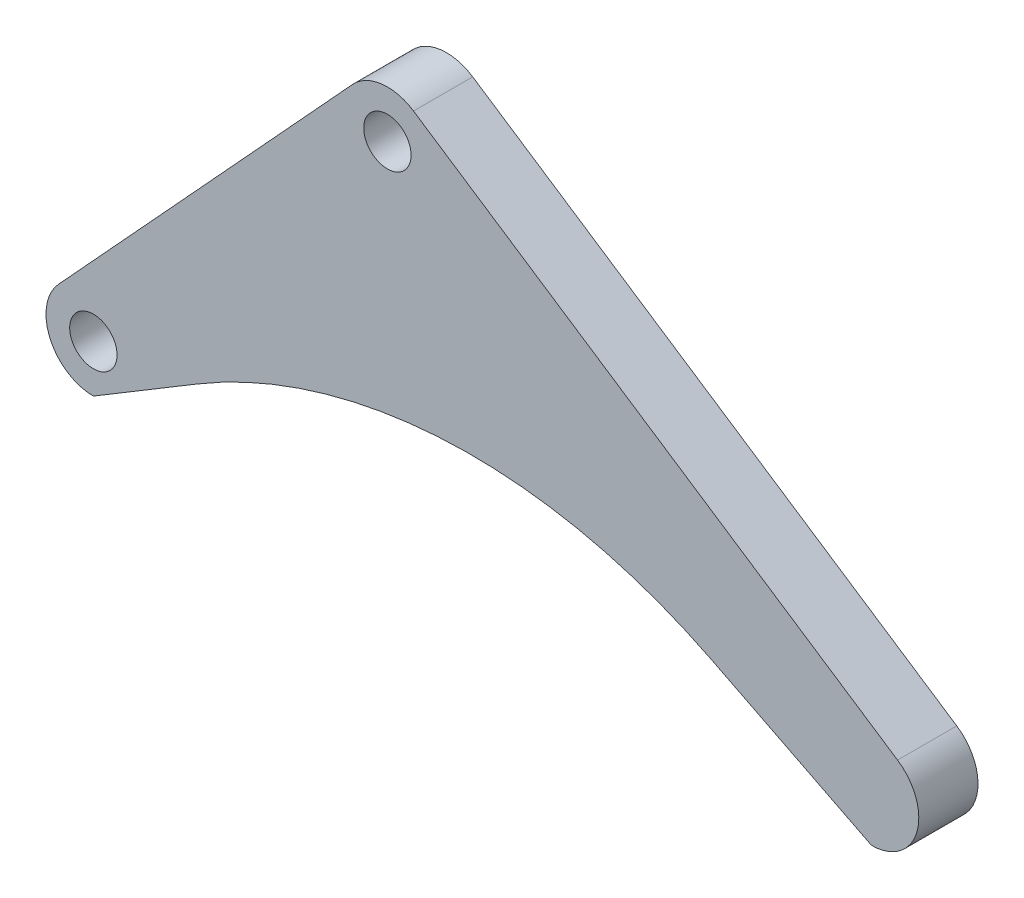
from build123d import *

# Parameters (mm, degrees)
SKETCH_2_R      = 2
EXTRUDE_1_DEPTH = 2.5


with BuildPart() as part:
    # 草圖2 → 填料-伸長1 (new, symmetric)
    with BuildSketch(Plane.XY):
        with BuildLine():
            Line((27.034153101, 30.363667163), (67.906299219, 3.336501724))
            ThreePointArc((67.906299219, 3.336501724), (69.530535661, -1.151953364), (65.7, -4))
            Line((65.7, -4), (52.175653003, 2.831217066))
            ThreePointArc((52.175653003, 2.831217066), (30.231729467, 7.633890773), (8.700316547, 1.230788983))
            Line((8.700316547, 1.230788983), (0, -4))
            ThreePointArc((0, -4), (-3.662248796, -1.608705616), (-2.945740102, 2.706033121))
            Line((-2.945740102, 2.706033121), (21.882113779, 29.733198559))
            ThreePointArc((21.882113779, 29.733198559), (24.341987779, 30.997547553), (27.034153101, 30.363667163))
        make_face()
        Circle(SKETCH_2_R, mode=Mode.SUBTRACT)
        with Locations((24.827853881, 27.027165439)):
            Circle(SKETCH_2_R, mode=Mode.SUBTRACT)
    extrude(amount=EXTRUDE_1_DEPTH, both=True)


solid = part.part
